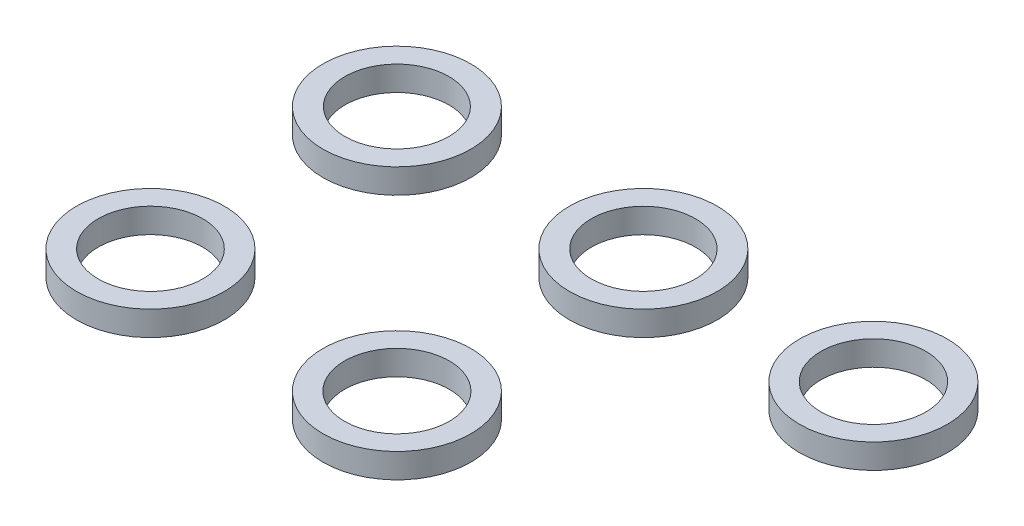
from build123d import *

# Parameters (mm, degrees)
SKETCH1_R             = 15
SKETCH1_R_2           = 10.55
BOSS_EXTRUDE1_DEPTH   = 5
SKETCH1_R_3           = 10.575
BOSS_EXTRUDE1_2_DEPTH = 5
SKETCH1_R_4           = 10.6
BOSS_EXTRUDE1_3_DEPTH = 5
SKETCH1_R_5           = 10.625
BOSS_EXTRUDE1_4_DEPTH = 5
SKETCH1_R_6           = 10.65
BOSS_EXTRUDE1_5_DEPTH = 5


with BuildPart() as part:
    # Sketch1 → Boss-Extrude1 (new body)
    with BuildSketch(Plane(origin=(0, 0, 0), x_dir=(1, 0, 0), z_dir=(0, 1, 0))):
        with Locations(Location((0, 0, 0), (0, 0, 270))):
            Circle(SKETCH1_R)
        with Locations(Location((0, 0, 0), (0, 0, 270))):
            Circle(SKETCH1_R_2, mode=Mode.SUBTRACT)
    extrude(amount=BOSS_EXTRUDE1_DEPTH)


with BuildPart() as body_2:
    # Sketch1 → Boss-Extrude1 2 (new body)
    with BuildSketch(Plane(origin=(0, 0, 0), x_dir=(1, 0, 0), z_dir=(0, 1, 0))):
        with Locations(Location((50, 0, 0), (0, 0, 270))):
            Circle(SKETCH1_R)
        with Locations(Location((50, 0, 0), (0, 0, 270))):
            Circle(SKETCH1_R_3, mode=Mode.SUBTRACT)
    extrude(amount=BOSS_EXTRUDE1_2_DEPTH)


with BuildPart() as body_3:
    # Sketch1 → Boss-Extrude1 3 (new body)
    with BuildSketch(Plane(origin=(0, 0, 0), x_dir=(1, 0, 0), z_dir=(0, 1, 0))):
        with Locations(Location((0, -50, 0), (0, 0, 270))):
            Circle(SKETCH1_R)
        with Locations(Location((0, -50, 0), (0, 0, 270))):
            Circle(SKETCH1_R_4, mode=Mode.SUBTRACT)
    extrude(amount=BOSS_EXTRUDE1_3_DEPTH)


with BuildPart() as body_4:
    # Sketch1 → Boss-Extrude1 4 (new body)
    with BuildSketch(Plane(origin=(0, 0, 0), x_dir=(1, 0, 0), z_dir=(0, 1, 0))):
        with Locations(Location((50, -50, 0), (0, 0, 270))):
            Circle(SKETCH1_R)
        with Locations(Location((50, -50, 0), (0, 0, 270))):
            Circle(SKETCH1_R_5, mode=Mode.SUBTRACT)
    extrude(amount=BOSS_EXTRUDE1_4_DEPTH)


with BuildPart() as body_5:
    # Sketch1 → Boss-Extrude1 5 (new body)
    with BuildSketch(Plane(origin=(0, 0, 0), x_dir=(1, 0, 0), z_dir=(0, 1, 0))):
        with Locations(Location((96.672369259, 0, 0), (0, 0, 270))):
            Circle(SKETCH1_R)
        with Locations(Location((96.672369259, 0, 0), (0, 0, 270))):
            Circle(SKETCH1_R_6, mode=Mode.SUBTRACT)
    extrude(amount=BOSS_EXTRUDE1_5_DEPTH)


solid = Compound([part.part, body_2.part, body_3.part, body_4.part, body_5.part])
